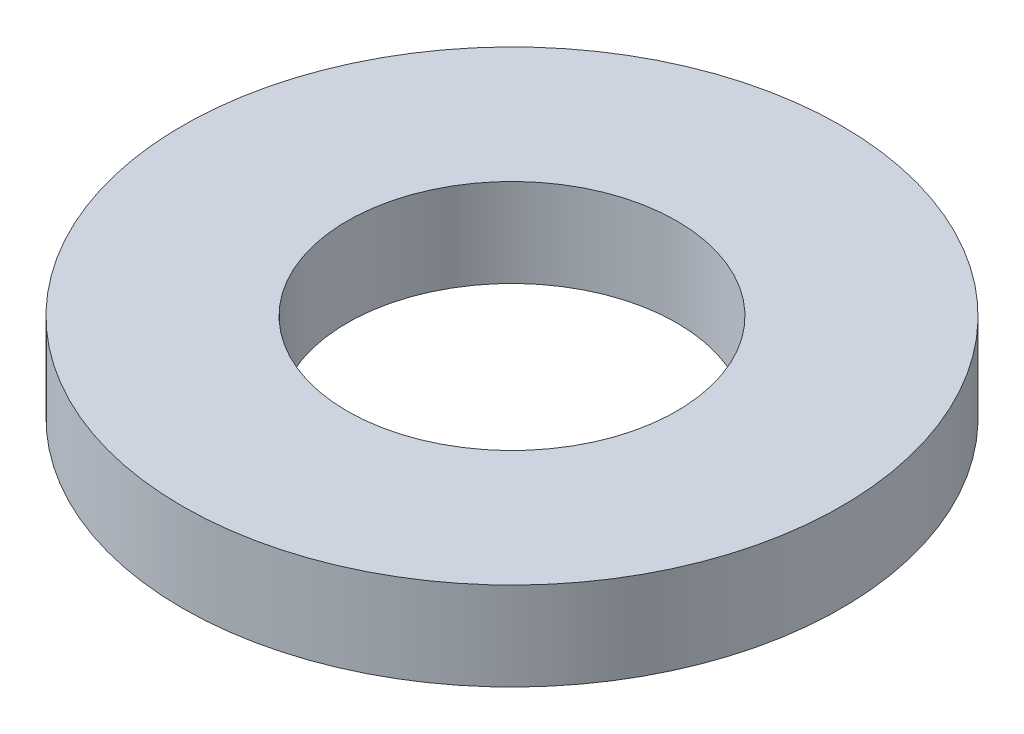
from build123d import *

# Parameters (mm, degrees)
SKETCH1_R           = 6.35
BOSS_EXTRUDE1_DEPTH = 1.7018
SKETCH5_R           = 3.175
CUT_EXTRUDE1_DEPTH  = 10.140083328


with BuildPart() as part:
    # Sketch1 → Boss-Extrude1 (new body)
    with BuildSketch(Plane(origin=(0, 0, 0), x_dir=(1, 0, 0), z_dir=(0, 1, 0))):
        with Locations(Location((0, 0, 0), (0, 0, 270))):
            Circle(SKETCH1_R)
    extrude(amount=BOSS_EXTRUDE1_DEPTH)

    # Sketch5 → Cut-Extrude1 (cut, through all)
    with BuildSketch(Plane(origin=(0, 1.7018, 0), x_dir=(-1, 0, 0), z_dir=(0, 1, 0))):
        with Locations(Location((0, 0, 0), (0, 0, 90))):
            Circle(SKETCH5_R)
    extrude(amount=-CUT_EXTRUDE1_DEPTH, mode=Mode.SUBTRACT)


solid = part.part
